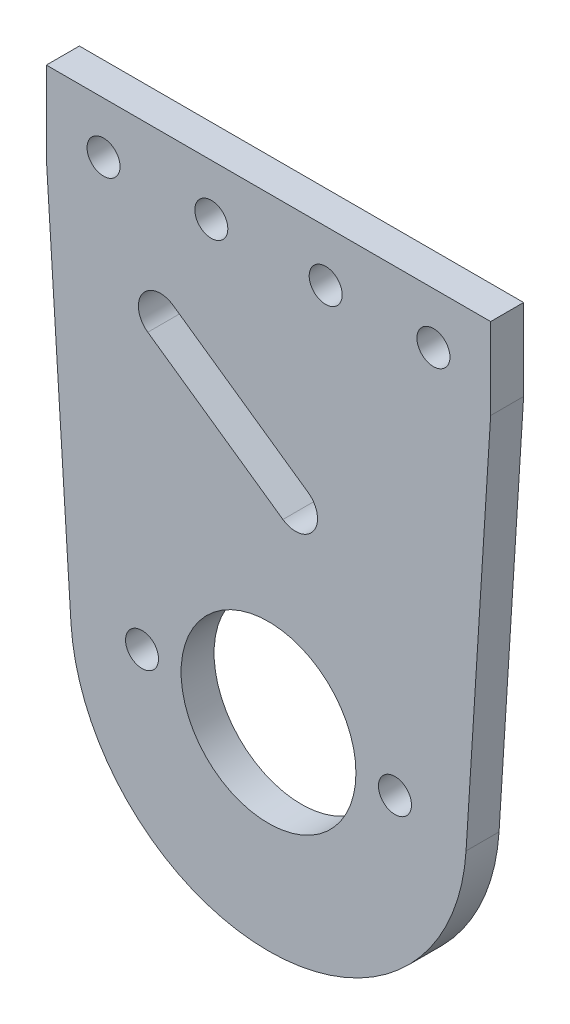
from build123d import *

# Parameters (mm, degrees)
SKETCH1_R               = 7.95
SKETCH1_R_2             = 1.5
MAIN_BODY_LINK_B2_DEPTH = 3
CUT_EXTRUDE1_REACH      = 48.409
SKETCH2_R               = 1.5
CUT_EXTRUDE2_DEPTH      = 47.408691448


with BuildPart() as part:
    # Sketch1 → Main Body Link B2 (new body)
    with BuildSketch(Plane.XY):
        with BuildLine():
            Line((0, 41.674052381), (20.2, 41.674052381))
            Line((20.2, 41.674052381), (20.2, 34.274052381))
            Line((20.2, 34.274052381), (17.964224051, -1.134307826))
            ThreePointArc((17.964224051, -1.134307826), (0, -18), (-17.964224051, -1.134307826))
            Line((-17.964224051, -1.134307826), (-20.2, 34.274052381))
            Line((-20.2, 34.274052381), (-20.2, 41.674052381))
            Line((-20.2, 41.674052381), (0, 41.674052381))
        make_face()
        Circle(SKETCH1_R, mode=Mode.SUBTRACT)
        with Locations((-15, 37.024052381)):
            Circle(SKETCH1_R_2, mode=Mode.SUBTRACT)
        with Locations((-5.2, 37.024052381)):
            Circle(SKETCH1_R_2, mode=Mode.SUBTRACT)
        with Locations((5.2, 37.024052381)):
            Circle(SKETCH1_R_2, mode=Mode.SUBTRACT)
        with Locations((15, 37.024052381)):
            Circle(SKETCH1_R_2, mode=Mode.SUBTRACT)
    extrude(amount=MAIN_BODY_LINK_B2_DEPTH)

    # Sketch2 → Cut-Extrude1 (cut, up to next)
    with BuildSketch(Plane.XY.offset(3), mode=Mode.PRIVATE) as cut_extrude1_sk1:
        with Locations((-11.5, 0)):
            Circle(SKETCH2_R)
    cut_extrude1_tool1 = extrude(cut_extrude1_sk1.sketch, amount=-CUT_EXTRUDE1_REACH, mode=Mode.PRIVATE) & part.part
    # Sketch2 → Cut-Extrude1 (cut, up to next)
    with BuildSketch(Plane.XY.offset(3), mode=Mode.PRIVATE) as cut_extrude1_sk2:
        with Locations((11.5, 0)):
            Circle(SKETCH2_R)
    cut_extrude1_tool2 = extrude(cut_extrude1_sk2.sketch, amount=-CUT_EXTRUDE1_REACH, mode=Mode.PRIVATE) & part.part
    add(cut_extrude1_tool1.solids().sort_by_distance((-11.5, 0, 3))[0], mode=Mode.SUBTRACT)
    add(cut_extrude1_tool2.solids().sort_by_distance((11.5, 0, 3))[0], mode=Mode.SUBTRACT)

    # Sketch3 → Cut-Extrude2 (cut, through all)
    with BuildSketch(Plane.XY.offset(3)):
        with BuildLine():
            Line((-8.682671659, 28.521221325), (3.604609006, 19.91757478))
            ThreePointArc((3.604609006, 19.91757478), (4.095760221, 17.132117818), (1.31030326, 16.640966602))
            Line((1.31030326, 16.640966602), (-10.976977404, 25.244613148))
            ThreePointArc((-10.976977404, 25.244613148), (-11.46812862, 28.030070109), (-8.682671659, 28.521221325))
        make_face()
    extrude(amount=-CUT_EXTRUDE2_DEPTH, mode=Mode.SUBTRACT)


solid = part.part
